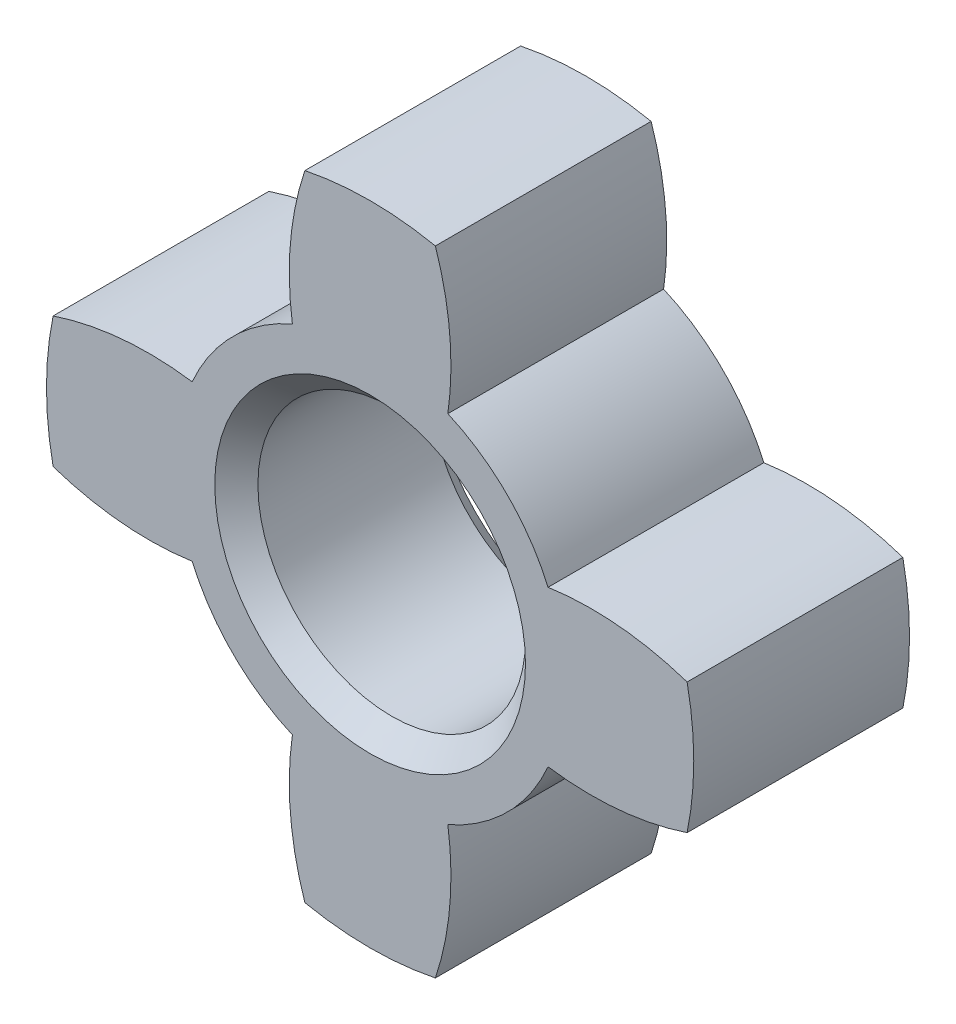
from build123d import *

# Parameters (mm, degrees)
SKETCH2_R          = 15
CUT_EXTRUDE1_DEPTH = 5


with BuildPart() as part:
    # Sketch1 → Revolve1 (revolve)
    with BuildSketch(Plane(origin=(0, 0, 0), x_dir=(0, 0, -1), z_dir=(1, 0, 0))):
        Polygon((-5, 7.5), (-5, 3.6), (-4.5, 3.1), (-0.5, 3.1), (0, 3.6), (0, 7.5), align=None)
    revolve(axis=Axis((0, 0, 0), (0, 0, 1)))

    # Sketch2 → Cut-Extrude1 (cut)
    with BuildSketch(Plane.XY):
        Circle(SKETCH2_R)
        with BuildLine():
            ThreePointArc((-9.892943155, 0), (-7.212770883, -1.555359899), (-4.123759488, -1.801279457))
            ThreePointArc((-4.123759488, -1.801279457), (-3.181980515, -3.181980515), (-1.801279457, -4.123759488))
            ThreePointArc((-1.801279457, -4.123759488), (-1.555359899, -7.212770883), (0, -9.892943155))
            ThreePointArc((0, -9.892943155), (1.555359899, -7.212770883), (1.801279457, -4.123759488))
            ThreePointArc((1.801279457, -4.123759488), (3.181980515, -3.181980515), (4.123759488, -1.801279457))
            ThreePointArc((4.123759488, -1.801279457), (7.212770883, -1.555359899), (9.892943155, 0))
            ThreePointArc((9.892943155, 0), (7.212770883, 1.555359899), (4.123759488, 1.801279457))
            ThreePointArc((4.123759488, 1.801279457), (3.181980515, 3.181980515), (1.801279457, 4.123759488))
            ThreePointArc((1.801279457, 4.123759488), (1.555359899, 7.212770883), (0, 9.892943155))
            ThreePointArc((0, 9.892943155), (-1.555359899, 7.212770883), (-1.801279457, 4.123759488))
            ThreePointArc((-1.801279457, 4.123759488), (-3.181980515, 3.181980515), (-4.123759488, 1.801279457))
            ThreePointArc((-4.123759488, 1.801279457), (-7.212770883, 1.555359899), (-9.892943155, 0))
        make_face(mode=Mode.SUBTRACT)
    extrude(amount=CUT_EXTRUDE1_DEPTH, mode=Mode.SUBTRACT)


solid = part.part
